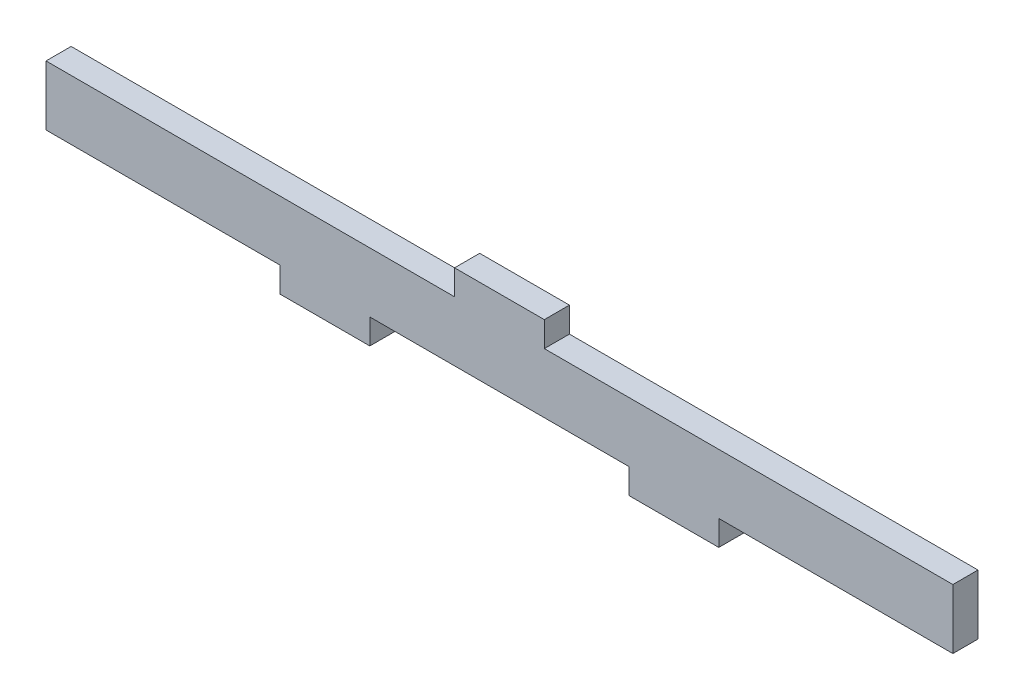
from build123d import *

# Parameters (mm, degrees)
SKETCH1_W           = 192.532
SKETCH1_H           = 23.368
BOSS_EXTRUDE1_DEPTH = 5.334
SKETCH2_W           = 49.699333333
SKETCH2_H           = 5.334
SKETCH2_W_2         = 55.033333334
SKETCH2_W_3         = 86.741
CUT_EXTRUDE1_DEPTH  = 195.018262037


with BuildPart() as part:
    # Sketch1 → Boss-Extrude1 (new body)
    with BuildSketch(Plane.XY):
        with Locations((96.266, 11.684)):
            Rectangle(SKETCH1_W, SKETCH1_H)
    extrude(amount=BOSS_EXTRUDE1_DEPTH)

    # Sketch2 → Cut-Extrude1 (cut, through all)
    with BuildSketch(Plane.XY.offset(5.334)):
        with Locations((24.849666667, 2.667)):
            Rectangle(SKETCH2_W, SKETCH2_H)
        with Locations((96.266, 2.667)):
            Rectangle(SKETCH2_W_2, SKETCH2_H)
        with Locations((167.682333334, 2.667)):
            Rectangle(SKETCH2_W, SKETCH2_H)
        with Locations((43.3705, 20.701)):
            Rectangle(SKETCH2_W_3, SKETCH2_H)
        with Locations((149.1615, 20.701)):
            Rectangle(SKETCH2_W_3, SKETCH2_H)
    extrude(amount=-CUT_EXTRUDE1_DEPTH, mode=Mode.SUBTRACT)


solid = part.part
